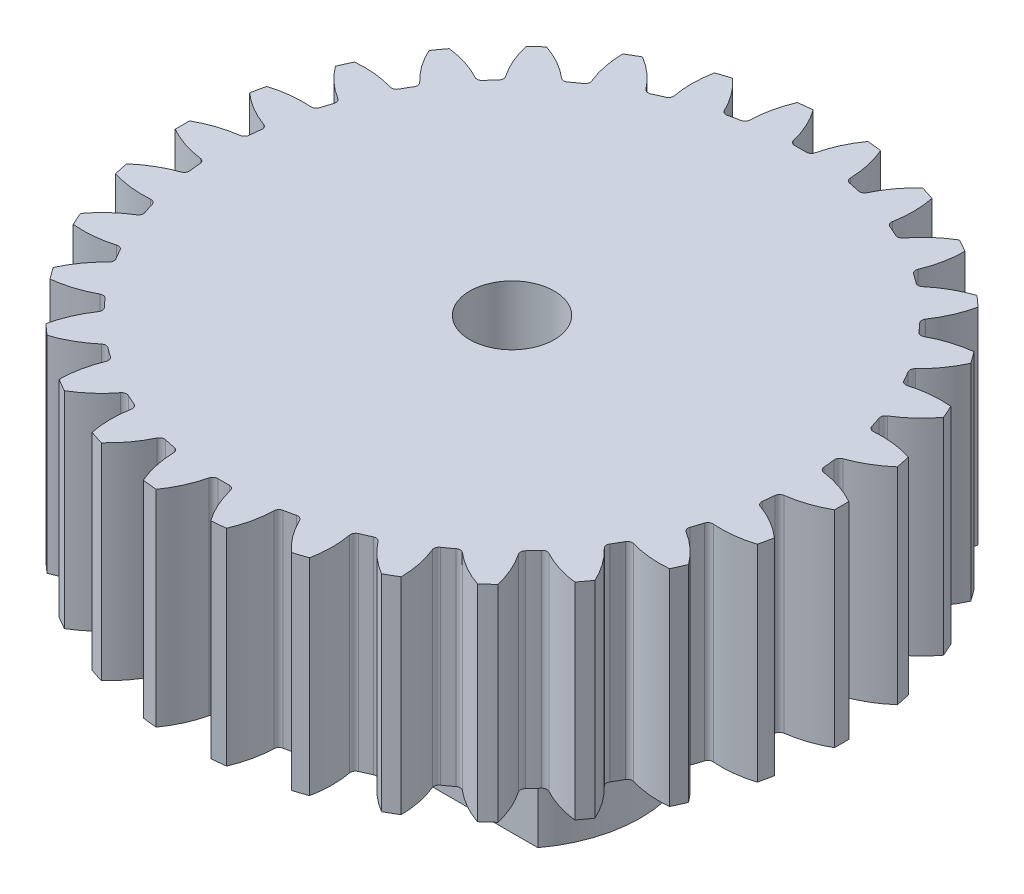
from build123d import *

# Parameters (mm, degrees)
SKETCH_1_R               = 32
EXTRUDE_1_DEPTH          = 20
SKETCH_2_R               = 12.5
EXTRUDE_2_DEPTH          = 16
CUT_EXTRUDE_1_REACH      = 51.477
PATTERN_CIRCULAR_1_COUNT = 30
CUT_EXTRUDE_4_DEPTH      = 50.406306916
CUT_EXTRUDE_4_DEPTH_BACK = 50.406306916
SKETCH_7_R               = 1.7
CUT_EXTRUDE_2_DEPTH      = 50.406306916
CUT_EXTRUDE_2_DEPTH_BACK = 50.406306916
SKETCH_5_R               = 4.1
CUT_EXTRUDE_START        = -12.5
SKETCH_8_W               = 25
SKETCH_8_H               = 16
CUT_EXTRUDE_5_DEPTH      = 5
CUT_EXTRUDE_START_2      = 12.5
SKETCH_8_2_W             = 25
SKETCH_8_2_H             = 16
CUT_EXTRUDE_6_DEPTH      = 5
CUT_EXTRUDE_START_3      = -36
CUT_EXTRUDE_7_DEPTH      = 15


with BuildPart() as part:
    # 草图1 → 凸台-拉伸1 (new body)
    with BuildSketch(Plane(origin=(0, 0, 0), x_dir=(1, 0, 0), z_dir=(0, 1, 0))):
        with Locations(Location((0, 0, 0), (0, 0, 270))):
            Circle(SKETCH_1_R)
    extrude(amount=EXTRUDE_1_DEPTH)

    # 草图2 → 凸台-拉伸2 (add)
    with BuildSketch(Plane(origin=(0, 0, 0), x_dir=(1, 0, 0), z_dir=(0, 1, 0))):
        with Locations(Location((0, 0, 0), (0, 0, 270))):
            Circle(SKETCH_2_R)
    extrude(amount=-EXTRUDE_2_DEPTH)

    # 草图4 → 切除-拉伸1 (cut, up to next)
    with BuildSketch(Plane(origin=(0, 0, 0), x_dir=(1, 0, 0), z_dir=(0, 1, 0)), mode=Mode.PRIVATE) as cut_extrude_1_sk1:
        with BuildLine():
            ThreePointArc((2.648931283, 31.890173456), (1.680358289, 30.209348228), (1.045459104, 28.376260637))
            ThreePointArc((1.045459104, 28.376260637), (0.864698852, 28.098347871), (0.549823647, 27.994601157))
            ThreePointArc((0.549823647, 27.994601157), (0, 28), (-0.549823647, 27.994601157))
            ThreePointArc((-0.549823647, 27.994601157), (-0.864698852, 28.098347871), (-1.045459104, 28.376260637))
            ThreePointArc((-1.045459104, 28.376260637), (-1.680358289, 30.209348228), (-2.648931283, 31.890173456))
            ThreePointArc((-2.648931283, 31.890173456), (0, 32), (2.648931283, 31.890173456))
        make_face()
    cut_extrude_1_tool1 = extrude(cut_extrude_1_sk1.sketch, amount=CUT_EXTRUDE_1_REACH, mode=Mode.PRIVATE) & part.part
    cut_extrude_1 = cut_extrude_1_tool1.solids().sort_by_distance((0, 0, -30.332736))[0]
    add(cut_extrude_1, mode=Mode.SUBTRACT)

    # 阵列(圆周)1: 切除-拉伸1 ×30 about axis
    pattern_circular_1_axis = Axis((0, 0, 0), (0, 1, 0))
    for i in range(1, PATTERN_CIRCULAR_1_COUNT):
        add(cut_extrude_1.rotate(pattern_circular_1_axis, i * 360 / PATTERN_CIRCULAR_1_COUNT), mode=Mode.SUBTRACT)

    # 草图7 → 切除-拉伸4 (cut, two sides: drawn at the far end of the back side and taken through both)
    with BuildSketch(Plane.XY.offset(-CUT_EXTRUDE_4_DEPTH_BACK)):
        with Locations((5.5, -8)):
            Circle(SKETCH_7_R)
        with Locations((-5.5, -8)):
            Circle(SKETCH_7_R)
    extrude(amount=CUT_EXTRUDE_4_DEPTH + CUT_EXTRUDE_4_DEPTH_BACK, mode=Mode.SUBTRACT)

    # 草图5 → 切除-拉伸2 (cut, two sides: drawn at the far end of the back side and taken through both)
    with BuildSketch(Plane(origin=(0, 0, 0), x_dir=(1, 0, 0), z_dir=(0, 1, 0)).offset(-CUT_EXTRUDE_2_DEPTH_BACK)):
        with Locations(Location((0, 0, 0), (0, 0, 270))):
            Circle(SKETCH_5_R)
    extrude(amount=CUT_EXTRUDE_2_DEPTH + CUT_EXTRUDE_2_DEPTH_BACK, mode=Mode.SUBTRACT)

    # 草图8 → 切除-拉伸5 (cut)
    with BuildSketch(Plane.XY.offset(CUT_EXTRUDE_START)):
        with Locations((0, -8)):
            Rectangle(SKETCH_8_W, SKETCH_8_H)
    extrude(amount=CUT_EXTRUDE_5_DEPTH, mode=Mode.SUBTRACT)

    # 草图8<2> → 切除-拉伸6 (cut)
    with BuildSketch(Plane.XY.offset(CUT_EXTRUDE_START_2)):
        with Locations((0, -8)):
            Rectangle(SKETCH_8_2_W, SKETCH_8_2_H)
    extrude(amount=-CUT_EXTRUDE_6_DEPTH, mode=Mode.SUBTRACT)

    # 草图9 → 切除-拉伸7 (cut)
    with BuildSketch(Plane(origin=(0, 20, 0), x_dir=(1, 0, 0), z_dir=(0, 1, 0)).offset(CUT_EXTRUDE_START_3)):
        with BuildLine():
            Line((3.764223027, 1.625), (5.4, 1.625))
            Line((5.4, 1.625), (5.4, -1.625))
            Line((5.4, -1.625), (3.764223027, -1.625))
            ThreePointArc((3.764223027, -1.625), (-4.1, 0), (3.764223027, 1.625))
        make_face()
    extrude(amount=CUT_EXTRUDE_7_DEPTH, mode=Mode.SUBTRACT)


solid = part.part
